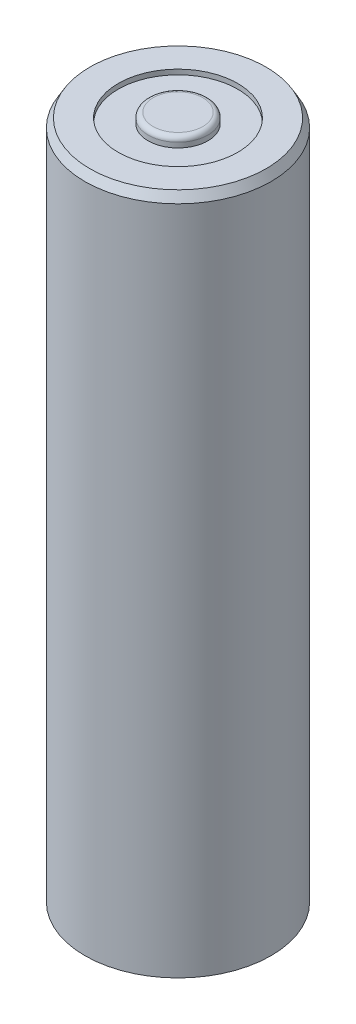
from build123d import *

# Parameters (mm, degrees)
SZKIC1_R                    = 9.35
DODANIE_WYCI_GNI_CIE1_DEPTH = 68.2
SZKIC2_R                    = 7
WYTNIJ_WYCI_GNI_CIE1_DEPTH  = 0.5
SZKIC3_R                    = 6
WYTNIJ_WYCI_GNI_CIE2_DEPTH  = 0.5
SZKIC4_R                    = 3
DODANIE_WYCI_GNI_CIE2_DEPTH = 1
ZAOKR_GLENIE1_R             = 0.5
SFAZOWANIE1_SIZE            = 0.5
SFAZOWANIE1_SIZE2           = 0.866025404


with BuildPart() as part:
    # Szkic1 → Dodanie-wyciągnięcie1 (new body)
    with BuildSketch(Plane(origin=(0, 0, 0), x_dir=(1, 0, 0), z_dir=(0, 1, 0))):
        with Locations(Location((0, 0, 0), (0, 0, 270))):
            Circle(SZKIC1_R)
    extrude(amount=DODANIE_WYCI_GNI_CIE1_DEPTH)

    # Szkic2 → Wytnij-wyciągnięcie1 (cut)
    with BuildSketch(Plane.XZ):
        with Locations(Location((0, 0, 0), (0, 0, 270))):
            Circle(SZKIC2_R)
    extrude(amount=-WYTNIJ_WYCI_GNI_CIE1_DEPTH, mode=Mode.SUBTRACT)

    # Szkic3 → Wytnij-wyciągnięcie2 (cut)
    with BuildSketch(Plane(origin=(0, 68.2, 0), x_dir=(1, 0, 0), z_dir=(0, 1, 0))):
        with Locations(Location((0, 0, 0), (0, 0, 270))):
            Circle(SZKIC3_R)
    extrude(amount=-WYTNIJ_WYCI_GNI_CIE2_DEPTH, mode=Mode.SUBTRACT)

    # Szkic4 → Dodanie-wyciągnięcie2 (add)
    with BuildSketch(Plane(origin=(0, 67.7, 0), x_dir=(1, 0, 0), z_dir=(0, 1, 0))):
        with Locations(Location((0, 0, 0), (0, 0, 270))):
            Circle(SZKIC4_R)
    extrude(amount=DODANIE_WYCI_GNI_CIE2_DEPTH)

    # Zaokrąglenie1
    zaokr_glenie1_edges = [part.edges().sort_by_distance(p)[0] for p in [
        (0, 68.7, -3),
    ]]
    fillet(zaokr_glenie1_edges, radius=ZAOKR_GLENIE1_R)

    # Sfazowanie1
    sfazowanie1_edges = [part.edges().sort_by_distance(p)[0] for p in [
        (0, 68.2, -9.35),
    ]]
    sfazowanie1_side = [part.faces().sort_by_distance(p)[0] for p in [
        (0, 68.2, -9.085542064),
    ]]
    chamfer(sfazowanie1_edges, length=SFAZOWANIE1_SIZE, length2=SFAZOWANIE1_SIZE2, reference=sfazowanie1_side[0])


solid = part.part
